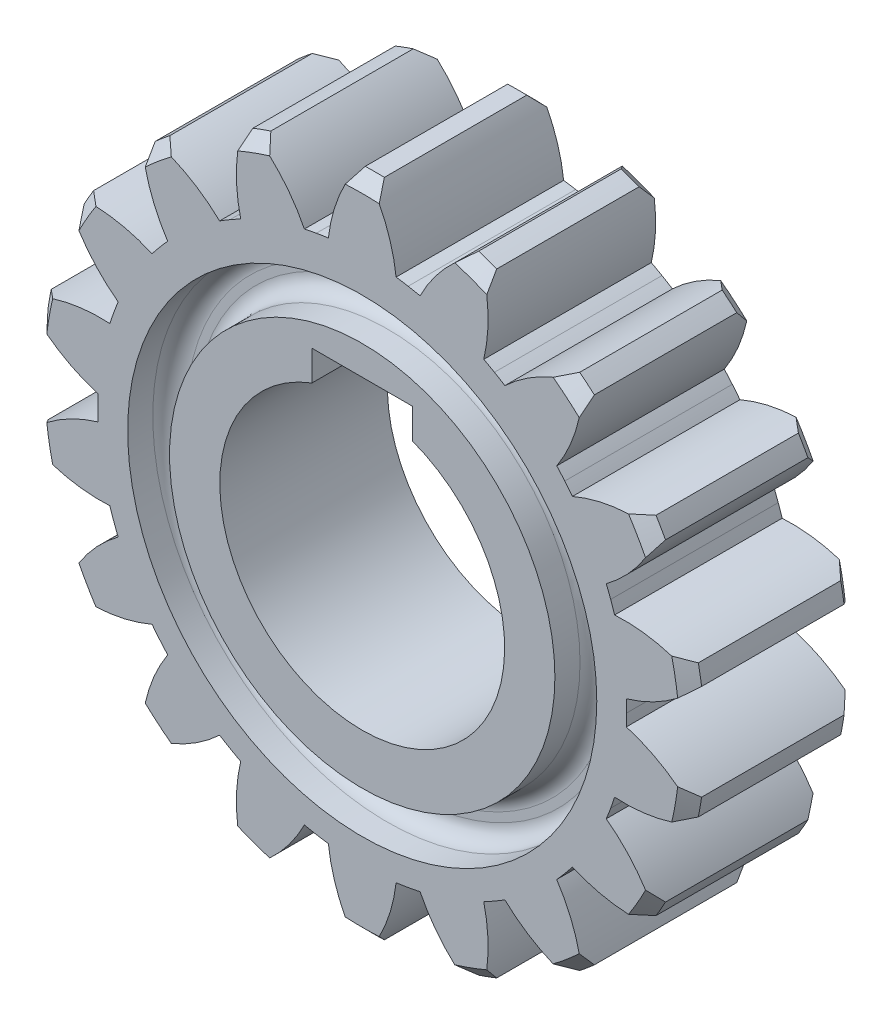
from build123d import *

# Parameters (mm, degrees)
BOSS_EXTRUDE1_DEPTH          = 10
CHAMFER1_SIZE                = 0.75
CIRPATTERN1_COUNT            = 18
CHAMFER1_OF_CIRPATTERN1_SIZE = 0.75
SKETCH2_R                    = 14
SKETCH2_R_2                  = 11.5
CUT_EXTRUDE1_DEPTH           = 2.5
FILLET1_R                    = 1
FILLET1_OF_MIRROR1_R         = 1
CUT_EXTRUDE2_REACH           = 31.674


with BuildPart() as part:
    # Sketch1 → Boss-Extrude1 (new body)
    with BuildSketch(Plane.XY):
        with BuildLine():
            ThreePointArc((-2.07, 15.361155555), (0, -15.5), (2.07, 15.361155555))
            ThreePointArc((2.07, 15.361155555), (1.622355789, 17.774455905), (0.57, 19.99187585))
            ThreePointArc((0.57, 19.99187585), (0, 20), (-0.57, 19.99187585))
            ThreePointArc((-0.57, 19.99187585), (-1.622355789, 17.774455905), (-2.07, 15.361155555))
        make_face()
    boss_extrude1 = extrude(amount=BOSS_EXTRUDE1_DEPTH)

    # Chamfer1
    chamfer1_edges = [part.edges().sort_by_distance(p)[0] for p in [
        (0, 20, 10),
        (0, 20, 0),
    ]]
    chamfer(chamfer1_edges, length=CHAMFER1_SIZE)

    # CirPattern1: Boss-Extrude1 ×18 about axis
    cirpattern1_axis = Axis((0, 0.284150659, 0), (0, 0, 1))
    for i in range(1, CIRPATTERN1_COUNT):
        add(boss_extrude1.rotate(cirpattern1_axis, i * 360 / CIRPATTERN1_COUNT))

    # Chamfer1 of CirPattern1
    chamfer1_of_cirpattern1_edges = [part.edges().sort_by_distance(p)[0] for p in [
        (-6.743217617, 18.810988797, 10),
        (-6.743217617, 18.810988797, 0),
        (-12.673103671, 15.387367488, 10),
        (-12.673103671, 15.387367488, 0),
        (-17.074426386, 10.14207533, 10),
        (-17.074426386, 10.14207533, 0),
        (-19.416321288, 3.707771968, 10),
        (-19.416321288, 3.707771968, 0),
        (-19.416321288, -3.13947065, 10),
        (-19.416321288, -3.13947065, 0),
        (-17.074426386, -9.573774011, 10),
        (-17.074426386, -9.573774011, 0),
        (-12.673103671, -14.81906617, 10),
        (-12.673103671, -14.81906617, 0),
        (-6.743217617, -18.242687479, 10),
        (-6.743217617, -18.242687479, 0),
        (0, -19.431698682, 10),
        (0, -19.431698682, 0),
        (6.743217617, -18.242687479, 10),
        (6.743217617, -18.242687479, 0),
        (12.673103671, -14.81906617, 10),
        (12.673103671, -14.81906617, 0),
        (17.074426386, -9.573774011, 10),
        (17.074426386, -9.573774011, 0),
        (19.416321288, -3.13947065, 10),
        (19.416321288, -3.13947065, 0),
        (19.416321288, 3.707771968, 10),
        (19.416321288, 3.707771968, 0),
        (17.074426386, 10.14207533, 10),
        (17.074426386, 10.14207533, 0),
        (12.673103671, 15.387367488, 10),
        (12.673103671, 15.387367488, 0),
        (6.743217617, 18.810988797, 10),
        (6.743217617, 18.810988797, 0),
    ]]
    chamfer(chamfer1_of_cirpattern1_edges, length=CHAMFER1_OF_CIRPATTERN1_SIZE)

    # Sketch2 → Cut-Extrude1 (cut)
    with BuildSketch(Plane.XY.offset(10)):
        Circle(SKETCH2_R)
        Circle(SKETCH2_R_2, mode=Mode.SUBTRACT)
    cut_extrude1 = extrude(amount=-CUT_EXTRUDE1_DEPTH, mode=Mode.SUBTRACT)

    # Fillet1
    fillet1_edges = [part.edges().sort_by_distance(p)[0] for p in [
        (-14, 0, 7.5),
        (-11.5, 0, 7.5),
    ]]
    fillet(fillet1_edges, radius=FILLET1_R)

    # Mirror1: Cut-Extrude1 across plane
    add(cut_extrude1.mirror(Plane.XY.offset(5)), mode=Mode.SUBTRACT)

    # Fillet1 of Mirror1
    fillet1_of_mirror1_edges = [part.edges().sort_by_distance(p)[0] for p in [
        (-14, 0, 2.5),
        (-11.5, 0, 2.5),
    ]]
    fillet(fillet1_of_mirror1_edges, radius=FILLET1_OF_MIRROR1_R)

    # Sketch3 → Cut-Extrude2 (cut, up to next)
    with BuildSketch(Plane.XY.offset(10), mode=Mode.PRIVATE) as cut_extrude2_sk1:
        with BuildLine():
            ThreePointArc((3, 7.95298686), (0, 8.5), (-3, 7.95298686))
            Line((-3, 7.95298686), (-3, 7.25))
            Line((-3, 7.25), (3, 7.25))
            Line((3, 7.25), (3, 7.95298686))
        make_face()
    cut_extrude2_tool1 = extrude(cut_extrude2_sk1.sketch, amount=-CUT_EXTRUDE2_REACH, mode=Mode.PRIVATE) & part.part
    # Sketch3 → Cut-Extrude2 (cut, up to next)
    with BuildSketch(Plane.XY.offset(10), mode=Mode.PRIVATE) as cut_extrude2_sk2:
        with BuildLine():
            Line((-3, 7.25), (-3, 7.95298686))
            ThreePointArc((-3, 7.95298686), (-4.834769901, -6.991065727), (8.5, 0))
            ThreePointArc((8.5, 0), (6.991065727, 4.834769901), (3, 7.95298686))
            Line((3, 7.95298686), (3, 7.25))
            Line((3, 7.25), (-3, 7.25))
        make_face()
    cut_extrude2_tool2 = extrude(cut_extrude2_sk2.sketch, amount=-CUT_EXTRUDE2_REACH, mode=Mode.PRIVATE) & part.part
    # Sketch3 → Cut-Extrude2 (cut, up to next)
    with BuildSketch(Plane.XY.offset(10), mode=Mode.PRIVATE) as cut_extrude2_sk3:
        with BuildLine():
            Line((3, 9.75), (-3, 9.75))
            Line((-3, 9.75), (-3, 7.95298686))
            ThreePointArc((-3, 7.95298686), (0, 8.5), (3, 7.95298686))
            Line((3, 7.95298686), (3, 9.75))
        make_face()
    cut_extrude2_tool3 = extrude(cut_extrude2_sk3.sketch, amount=-CUT_EXTRUDE2_REACH, mode=Mode.PRIVATE) & part.part
    # Sketch3 → Cut-Extrude2 (cut, up to next)
    with BuildSketch(Plane.XY.offset(10), mode=Mode.PRIVATE) as cut_extrude2_sk4:
        with BuildLine():
            ThreePointArc((3, 7.95298686), (0, 8.5), (-3, 7.95298686))
            Line((-3, 7.95298686), (-3, 7.25))
            Line((-3, 7.25), (3, 7.25))
            Line((3, 7.25), (3, 7.95298686))
        make_face()
    cut_extrude2_tool4 = extrude(cut_extrude2_sk4.sketch, amount=-CUT_EXTRUDE2_REACH, mode=Mode.PRIVATE) & part.part
    # Sketch3 → Cut-Extrude2 (cut, up to next)
    with BuildSketch(Plane.XY.offset(10), mode=Mode.PRIVATE) as cut_extrude2_sk5:
        with BuildLine():
            Line((-3, 7.25), (-3, 7.95298686))
            ThreePointArc((-3, 7.95298686), (-4.834769901, -6.991065727), (8.5, 0))
            ThreePointArc((8.5, 0), (6.991065727, 4.834769901), (3, 7.95298686))
            Line((3, 7.95298686), (3, 7.25))
            Line((3, 7.25), (-3, 7.25))
        make_face()
    cut_extrude2_tool5 = extrude(cut_extrude2_sk5.sketch, amount=-CUT_EXTRUDE2_REACH, mode=Mode.PRIVATE) & part.part
    add(cut_extrude2_tool1.solids().sort_by_distance((0, 7.797345, 10))[0], mode=Mode.SUBTRACT)
    add(cut_extrude2_tool2.solids().sort_by_distance((0, -0.226979, 10))[0], mode=Mode.SUBTRACT)
    add(cut_extrude2_tool3.solids().sort_by_distance((0, 9.025828, 10))[0], mode=Mode.SUBTRACT)
    add(cut_extrude2_tool4.solids().sort_by_distance((0, 7.797345, 10))[0], mode=Mode.SUBTRACT)
    add(cut_extrude2_tool5.solids().sort_by_distance((0, -0.226979, 10))[0], mode=Mode.SUBTRACT)


solid = part.part
